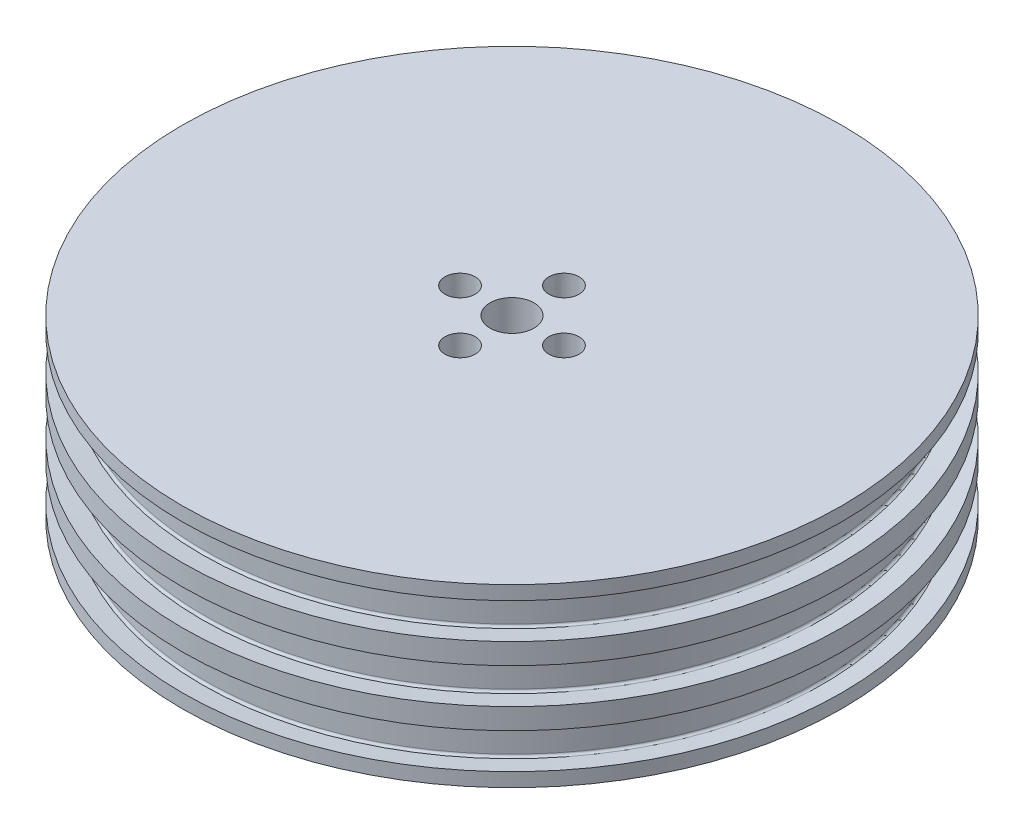
from build123d import *

# Parameters (mm, degrees)
SKETCH1_R           = 38.1
BOSS_EXTRUDE1_DEPTH = 20.32
FILLET1_R           = 0.254
SKETCH3_R           = 2.54
CUT_EXTRUDE1_DEPTH  = 58.5857831
SKETCH4_R           = 12.7
CUT_EXTRUDE2_DEPTH  = 10.16
SKETCH5_R           = 1.75
CUT_EXTRUDE3_DEPTH  = 12.7
SKETCH6_R           = 1.75
CUT_EXTRUDE4_DEPTH  = 5.08


with BuildPart() as part:
    # Sketch1 → Boss-Extrude1 (new body)
    with BuildSketch(Plane(origin=(0, 0, 0), x_dir=(1, 0, 0), z_dir=(0, 1, 0))):
        with Locations(Location((0, 0, 0), (0, 0, 270))):
            Circle(SKETCH1_R)
    extrude(amount=BOSS_EXTRUDE1_DEPTH)

    # Sketch2 → Cut-Revolve1 (revolve, cut)
    with BuildSketch(Plane(origin=(0, 0, 0), x_dir=(0, 0, -1), z_dir=(1, 0, 0)), mode=Mode.PRIVATE) as cut_revolve1_sk:
        Polygon((-40.64, 18.381205312), (-40.64, 14.956294688), (-35.56, 14.2875), (-35.56, 19.05), align=None)
        Polygon((-40.64, 11.872455312), (-40.64, 8.447544688), (-35.56, 7.77875), (-35.56, 12.54125), align=None)
        Polygon((-40.64, 5.363705312), (-40.64, 1.938794688), (-35.56, 1.27), (-35.56, 6.0325), align=None)
    revolve(cut_revolve1_sk.sketch.rotate(Axis((0, 0, 0), (0, 1, 0)), 180), axis=Axis((0, 0, 0), (0, 1, 0)), mode=Mode.SUBTRACT)

    # Fillet1
    fillet1_edges = [part.edges().sort_by_distance(p)[0] for p in [
        (0, 12.54125, 35.56),
        (0, 7.77875, 35.56),
        (0, 6.0325, 35.56),
        (0, 1.27, 35.56),
        (0, 19.05, 35.56),
        (0, 14.2875, 35.56),
    ]]
    fillet(fillet1_edges, radius=FILLET1_R)

    # Sketch3 → Cut-Extrude1 (cut, through all)
    with BuildSketch(Plane.XZ):
        with Locations(Location((0, 0, 0), (0, 0, 270))):
            Circle(SKETCH3_R)
    extrude(amount=-CUT_EXTRUDE1_DEPTH, mode=Mode.SUBTRACT)

    # Sketch4 → Cut-Extrude2 (cut)
    with BuildSketch(Plane.XZ):
        with Locations(Location((0, 0, 0), (0, 0, 270))):
            Circle(SKETCH4_R)
    extrude(amount=-CUT_EXTRUDE2_DEPTH, mode=Mode.SUBTRACT)

    # Sketch5 → Cut-Extrude3 (cut)
    with BuildSketch(Plane.XZ.offset(-10.16)):
        with Locations(Location((0, 6, 0), (0, 0, 270))):
            Circle(SKETCH5_R)
        with Locations(Location((6, 0, 0), (0, 0, 270))):
            Circle(SKETCH5_R)
        with Locations(Location((0, -6, 0), (0, 0, 270))):
            Circle(SKETCH5_R)
        with Locations(Location((-6, 0, 0), (0, 0, 270))):
            Circle(SKETCH5_R)
    extrude(amount=-CUT_EXTRUDE3_DEPTH, mode=Mode.SUBTRACT)

    # Sketch6 → Cut-Extrude4 (cut)
    with BuildSketch(Plane.XZ.offset(-10.16)):
        with BuildLine():
            ThreePointArc((-3.449499722, 3.449499722), (-10.29, 0), (-3.449499722, -3.449499722))
            ThreePointArc((-3.449499722, -3.449499722), (0, -10.29), (3.449499722, -3.449499722))
            ThreePointArc((3.449499722, -3.449499722), (10.29, 0), (3.449499722, 3.449499722))
            ThreePointArc((3.449499722, 3.449499722), (0, 10.29), (-3.449499722, 3.449499722))
        make_face()
        with Locations(Location((-6, 0, 0), (0, 0, 270))):
            Circle(SKETCH6_R, mode=Mode.SUBTRACT)
        with Locations(Location((0, -6, 0), (0, 0, 270))):
            Circle(SKETCH6_R, mode=Mode.SUBTRACT)
        with Locations(Location((6, 0, 0), (0, 0, 270))):
            Circle(SKETCH6_R, mode=Mode.SUBTRACT)
        with Locations(Location((0, 6, 0), (0, 0, 270))):
            Circle(SKETCH6_R, mode=Mode.SUBTRACT)
    extrude(amount=-CUT_EXTRUDE4_DEPTH, mode=Mode.SUBTRACT)


solid = part.part
